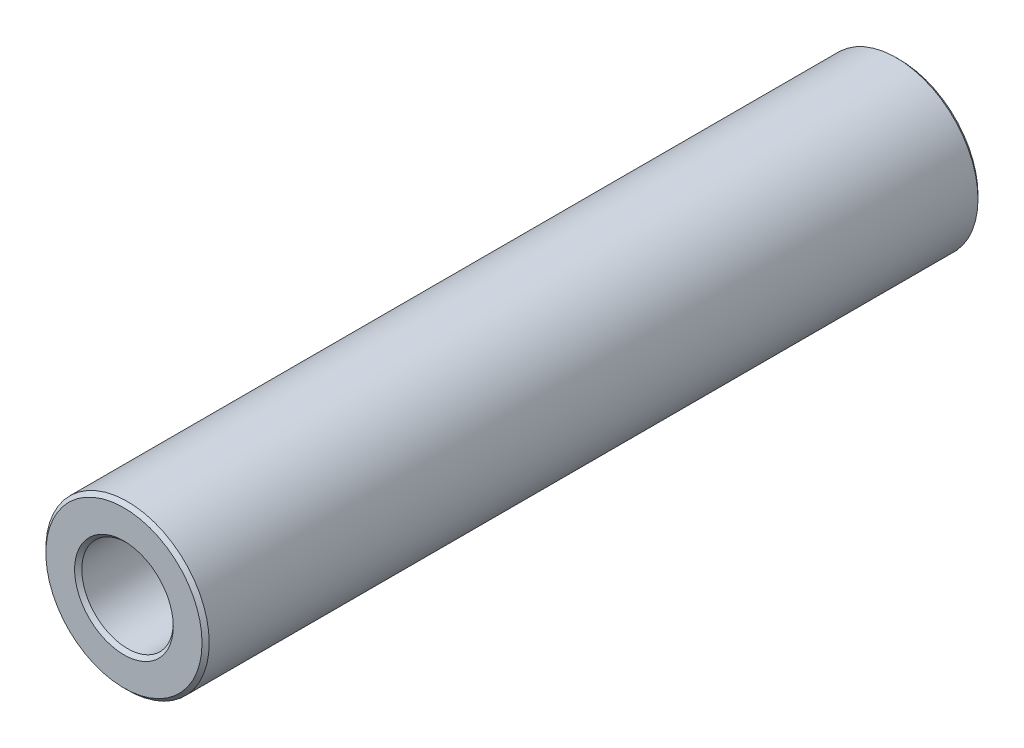
from build123d import *

# Parameters (mm, degrees)
BOSS_EXTRUDE1_DEPTH      = 15.08125
BOSS_EXTRUDE1_DEPTH_BACK = 15.08125
SKETCH3_R                = 3.175
SKETCH3_R_2              = 1.778
CHAMFER1_SIZE            = 0.1397


with BuildPart() as part:
    # Sketch3 → Boss-Extrude1 (new, two sides: drawn at the far end of the back side and taken through both)
    with BuildSketch(Plane.XY.offset(-BOSS_EXTRUDE1_DEPTH_BACK)):
        Circle(SKETCH3_R)
        Circle(SKETCH3_R_2, mode=Mode.SUBTRACT)
    extrude(amount=BOSS_EXTRUDE1_DEPTH + BOSS_EXTRUDE1_DEPTH_BACK)

    # Chamfer1
    chamfer1_edges = [part.edges().sort_by_distance(p)[0] for p in [
        (-3.175, 0, -15.08125),
        (-1.778, 0, -15.08125),
        (-3.175, 0, 15.08125),
        (-1.778, 0, 15.08125),
    ]]
    chamfer(chamfer1_edges, length=CHAMFER1_SIZE)


solid = part.part
